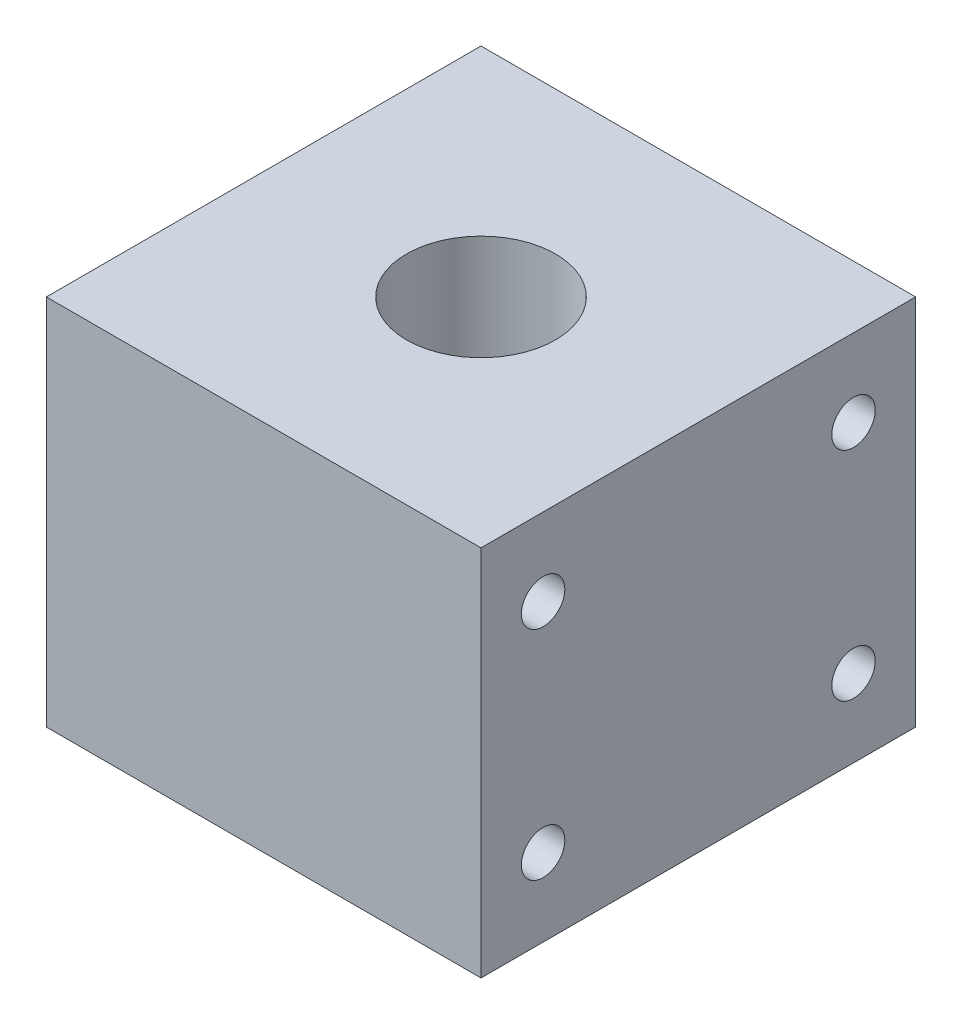
from build123d import *

# Parameters (mm, degrees)
SZKIC1_W                            = 70
SZKIC1_H                            = 70
SZKIC1_R                            = 12
DODANIE_WYCI_GNI_CIE1_DEPTH         = 60
SZKIC1_3_R                          = 23.5
WYTNIJ_WYCI_GNI_CIE1_DEPTH          = 3
SZKIC1_4_R                          = 23.5
WYTNIJ_WYCI_GNI_CIE2_DEPTH          = 23
SZKIC1_6_R                          = 16
SZKIC1_6_R_2                        = 12
WYTNIJ_WYCI_GNI_CIE5_DEPTH          = 40
SFAZOWANIE1_SIZE                    = 2
SFAZOWANIE2_SIZE                    = 2
OTW_R_GWINTOWANY_M8X1_01_AT_2_COUNT = 2
OTW_R_GWINTOWANY_M8X1_01_AT_2_PITCH = 50
OTW_R_GWINTOWANY_M8X1_01_AT_3_COUNT = 2
OTW_R_GWINTOWANY_M8X1_01_AT_3_PITCH = 35
OTW_R_GWINTOWANY_M8X1_01_AT_4_COUNT = 2
OTW_R_GWINTOWANY_M8X1_01_AT_4_PITCH = 61.032778079


with BuildPart() as part:
    # Szkic1 → Dodanie-wyciągnięcie1 (new body)
    with BuildSketch(Plane(origin=(0, 0, 0), x_dir=(1, 0, 0), z_dir=(0, 1, 0))):
        with Locations((35, 35)):
            Rectangle(SZKIC1_W, SZKIC1_H)
        with Locations((35, 35)):
            Circle(SZKIC1_R, mode=Mode.SUBTRACT)
    extrude(amount=DODANIE_WYCI_GNI_CIE1_DEPTH)

    # Szkic1<3> → Wytnij-wyciągnięcie1 (cut)
    with BuildSketch(Plane(origin=(0, 0, 0), x_dir=(1, 0, 0), z_dir=(0, 1, 0))):
        with BuildLine():
            Line((5, 55), (5, 35))
            Line((5, 35), (5, 15))
            ThreePointArc((5, 15), (7.928932188, 7.928932188), (15, 5))
            Line((15, 5), (55, 5))
            ThreePointArc((55, 5), (62.071067812, 7.928932188), (65, 15))
            Line((65, 15), (65, 55))
            ThreePointArc((65, 55), (62.071067812, 62.071067812), (55, 65))
            Line((55, 65), (15, 65))
            ThreePointArc((15, 65), (7.928932188, 62.071067812), (5, 55))
        make_face()
        with Locations((35, 35)):
            Circle(SZKIC1_3_R, mode=Mode.SUBTRACT)
    extrude(amount=WYTNIJ_WYCI_GNI_CIE1_DEPTH, mode=Mode.SUBTRACT)

    # Szkic1<4> → Wytnij-wyciągnięcie2 (cut)
    with BuildSketch(Plane(origin=(0, 0, 0), x_dir=(1, 0, 0), z_dir=(0, 1, 0))):
        with Locations((35, 35)):
            Circle(SZKIC1_4_R)
    extrude(amount=WYTNIJ_WYCI_GNI_CIE2_DEPTH, mode=Mode.SUBTRACT)

    # Szkic1<6> → Wytnij-wyciągnięcie5 (cut)
    with BuildSketch(Plane(origin=(0, 0, 0), x_dir=(1, 0, 0), z_dir=(0, 1, 0))):
        with Locations((35, 35)):
            Circle(SZKIC1_6_R)
        with Locations((35, 35)):
            Circle(SZKIC1_6_R_2, mode=Mode.SUBTRACT)
    extrude(amount=WYTNIJ_WYCI_GNI_CIE5_DEPTH, mode=Mode.SUBTRACT)

    # Sfazowanie1
    sfazowanie1_edges = [part.edges().sort_by_distance(p)[0] for p in [
        (23, 40, -35),
    ]]
    chamfer(sfazowanie1_edges, length=SFAZOWANIE1_SIZE)

    # Sfazowanie2
    sfazowanie2_edges = [part.edges().sort_by_distance(p)[0] for p in [
        (11.5, 3, -35),
    ]]
    chamfer(sfazowanie2_edges, length=SFAZOWANIE2_SIZE)

    # Szkic4 → Otwór gwintowany M8x1.01 (revolve, cut)
    with BuildSketch(Plane(origin=(70, 47.5, -10), x_dir=(0, 0, -1), z_dir=(0, 1, 0))):
        Polygon((0, 0), (0, 10.103012167), (3.5, 8), (3.5, 0), align=None)
    otw_r_gwintowany_m8x1_01 = revolve(axis=Axis((76.35, 47.5, -10), (-1, 0, 0)), mode=Mode.SUBTRACT)

    # Otwór gwintowany M8x1.01 at 2: Otwór gwintowany M8x1.01 ×2
    with Locations(*[(0, 0, -i * OTW_R_GWINTOWANY_M8X1_01_AT_2_PITCH) for i in range(1, OTW_R_GWINTOWANY_M8X1_01_AT_2_COUNT)]):
        add(otw_r_gwintowany_m8x1_01, mode=Mode.SUBTRACT)

    # Otwór gwintowany M8x1.01 at 3: Otwór gwintowany M8x1.01 ×2
    with Locations(*[(0, -i * OTW_R_GWINTOWANY_M8X1_01_AT_3_PITCH, 0) for i in range(1, OTW_R_GWINTOWANY_M8X1_01_AT_3_COUNT)]):
        add(otw_r_gwintowany_m8x1_01, mode=Mode.SUBTRACT)

    # Otwór gwintowany M8x1.01 at 4: Otwór gwintowany M8x1.01 ×2
    with Locations(*[Vector(0, -0.5734623443633283, -0.8192319205190405) * (i * OTW_R_GWINTOWANY_M8X1_01_AT_4_PITCH) for i in range(1, OTW_R_GWINTOWANY_M8X1_01_AT_4_COUNT)]):
        add(otw_r_gwintowany_m8x1_01, mode=Mode.SUBTRACT)

    # Lustro1: Otwór gwintowany M8x1.01 across plane
    add(otw_r_gwintowany_m8x1_01.mirror(Plane(origin=(35, 0, 0), x_dir=(0, 0, 1), z_dir=(1, 0, 0))), mode=Mode.SUBTRACT)

    # Lustro1 copy 1 sketch → Lustro1 copy 1 (revolve, cut)
    with BuildSketch(Plane(origin=(0, 47.5, -60), x_dir=(0, 0, -1), z_dir=(0, 1, 0))):
        Polygon((0, 0), (0, -10.103012167), (3.5, -8), (3.5, 0), align=None)
    revolve(axis=Axis((-6.35, 47.5, -60), (-1, 0, 0)), mode=Mode.SUBTRACT)

    # Lustro1 copy 2 sketch → Lustro1 copy 2 (revolve, cut)
    with BuildSketch(Plane(origin=(0, 12.5, -10), x_dir=(0, 0, -1), z_dir=(0, 1, 0))):
        Polygon((0, 0), (0, -10.103012167), (3.5, -8), (3.5, 0), align=None)
    revolve(axis=Axis((-6.35, 12.5, -10), (-1, 0, 0)), mode=Mode.SUBTRACT)

    # Lustro1 copy 3 sketch → Lustro1 copy 3 (revolve, cut)
    with BuildSketch(Plane(origin=(0, 12.5, -60), x_dir=(0, 0, -1), z_dir=(0, 1, 0))):
        Polygon((0, 0), (0, -10.103012167), (3.5, -8), (3.5, 0), align=None)
    revolve(axis=Axis((-6.35, 12.5, -60), (-1, 0, 0)), mode=Mode.SUBTRACT)


solid = part.part
